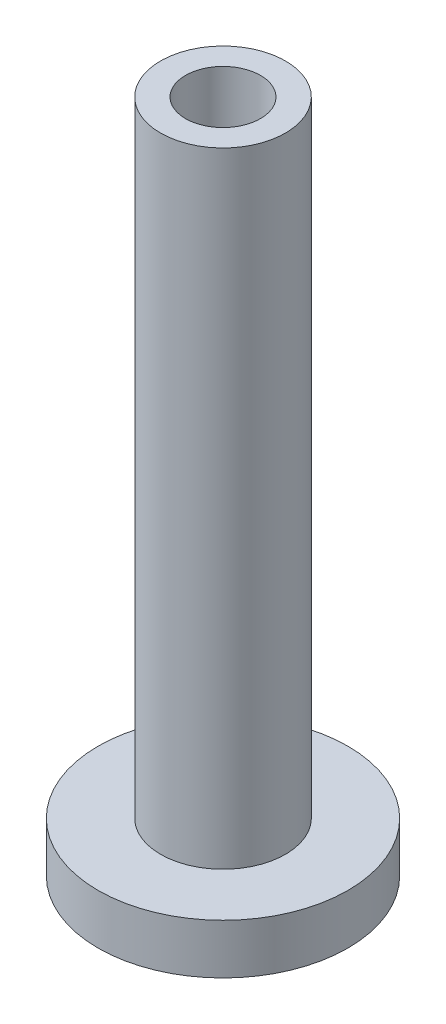
from build123d import *

# Parameters (mm, degrees)
SKETCH2_R           = 5
SKETCH2_R_2         = 2.5
BOSS_EXTRUDE1_DEPTH = 2
SKETCH2_3_R         = 2.5
BOSS_EXTRUDE2_DEPTH = 25
CUT_EXTRUDE1_START  = -25
SKETCH3_R           = 1.5
CUT_EXTRUDE1_DEPTH  = 53.910571474


with BuildPart() as part:
    # Sketch2 → Boss-Extrude1 (new body)
    # profile 1 of 2: a face of its own
    with BuildSketch(Plane(origin=(0, 0, 0), x_dir=(1, 0, 0), z_dir=(0, 1, 0))):
        with Locations(Location((0, 0, 0), (0, 0, 270))):
            Circle(SKETCH2_R)
        Circle(SKETCH2_R_2, mode=Mode.SUBTRACT)
    # profile 2 of 2: a face of its own
    with BuildSketch(Plane(origin=(0, 0, 0), x_dir=(1, 0, 0), z_dir=(0, 1, 0))):
        Circle(SKETCH2_R_2)
    extrude(amount=-BOSS_EXTRUDE1_DEPTH)

    # Sketch2<3> → Boss-Extrude2 (add)
    with BuildSketch(Plane(origin=(0, 0, 0), x_dir=(1, 0, 0), z_dir=(0, 1, 0))):
        with Locations(Location((0, 0, 0), (0, 0, 270))):
            Circle(SKETCH2_3_R)
    extrude(amount=BOSS_EXTRUDE2_DEPTH)

    # Sketch3 → Cut-Extrude1 (cut, through all)
    with BuildSketch(Plane(origin=(0, 25, 0), x_dir=(1, 0, 0), z_dir=(0, 1, 0)).offset(CUT_EXTRUDE1_START)):
        with Locations(Location((0, 0, 0), (0, 0, 270))):
            Circle(SKETCH3_R)
    extrude(amount=CUT_EXTRUDE1_DEPTH, mode=Mode.SUBTRACT)


solid = part.part
